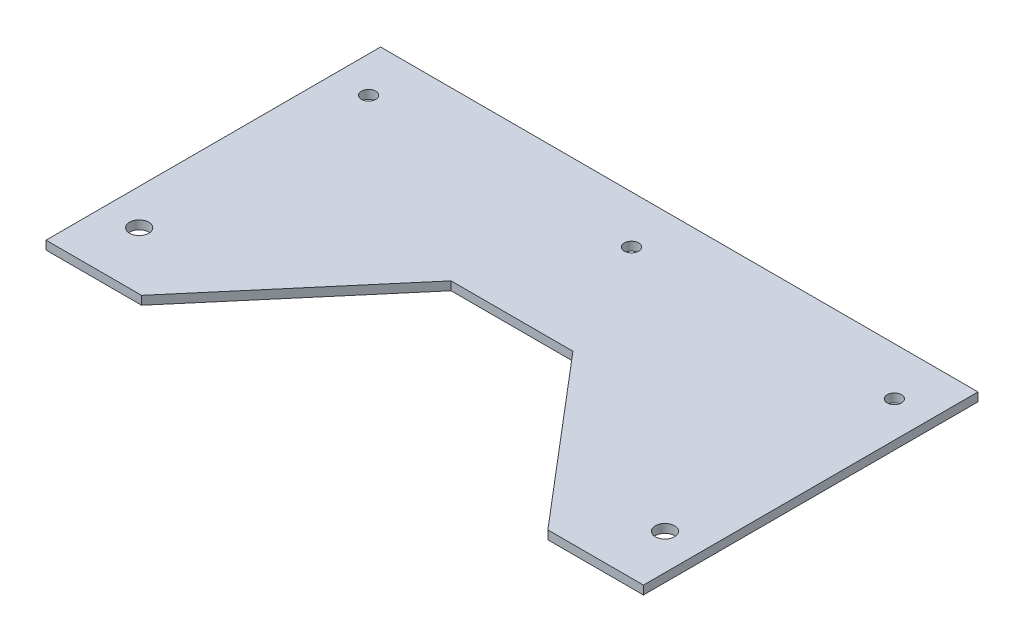
from build123d import *

# Parameters (mm, degrees)
SKETCH1_R           = 2.5527
SKETCH1_R_2         = 1.905
BOSS_EXTRUDE1_DEPTH = 1.143
SKETCH3_R           = 1.905
CUT_EXTRUDE1_DEPTH  = 135.670161968
SKETCH4_W           = 50.8
SKETCH4_H           = 19.05
BOSS_EXTRUDE2_DEPTH = 2.286


with BuildPart() as part:
    # Sketch1 → Boss-Extrude1 (new, symmetric)
    with BuildSketch(Plane(origin=(0, 0, 0), x_dir=(1, 0, 0), z_dir=(0, 1, 0))):
        Polygon((-45.965990991, 39.701801802), (33.409009009, 39.701801802), (33.409009009, -49.198198198), (8.009009009, -49.198198198), (-45.965990991, 14.301801802), align=None)
        with Locations(Location((23.884009009, -33.958198198, 0), (0, 0, 270))):
            Circle(SKETCH1_R, mode=Mode.SUBTRACT)
        with Locations(Location((23.884009009, 27.001801802, 0), (0, 0, 270))):
            Circle(SKETCH1_R_2, mode=Mode.SUBTRACT)
    boss_extrude1 = extrude(amount=BOSS_EXTRUDE1_DEPTH, both=True)

    # Mirror1: Boss-Extrude1 across plane
    add(boss_extrude1.mirror(Plane(origin=(-45.965990991, 1.143, 0), x_dir=(0, 0, 1), z_dir=(-1, 0, 0))))

    # Sketch3 → Cut-Extrude1 (cut, through all)
    with BuildSketch(Plane(origin=(0, 1.143, 0), x_dir=(1, 0, 0), z_dir=(0, 1, 0))):
        with Locations(Location((-45.965990991, 27.001801802, 0), (0, 0, 270))):
            Circle(SKETCH3_R)
    extrude(amount=-CUT_EXTRUDE1_DEPTH, mode=Mode.SUBTRACT)

    # Sketch4 → Boss-Extrude2 (add)
    with BuildSketch(Plane(origin=(0, 1.143, 0), x_dir=(1, 0, 0), z_dir=(0, 1, 0))):
        with Locations((-45.965990991, 4.776801802)):
            Rectangle(SKETCH4_W, SKETCH4_H)
    extrude(amount=-BOSS_EXTRUDE2_DEPTH)


solid = part.part
